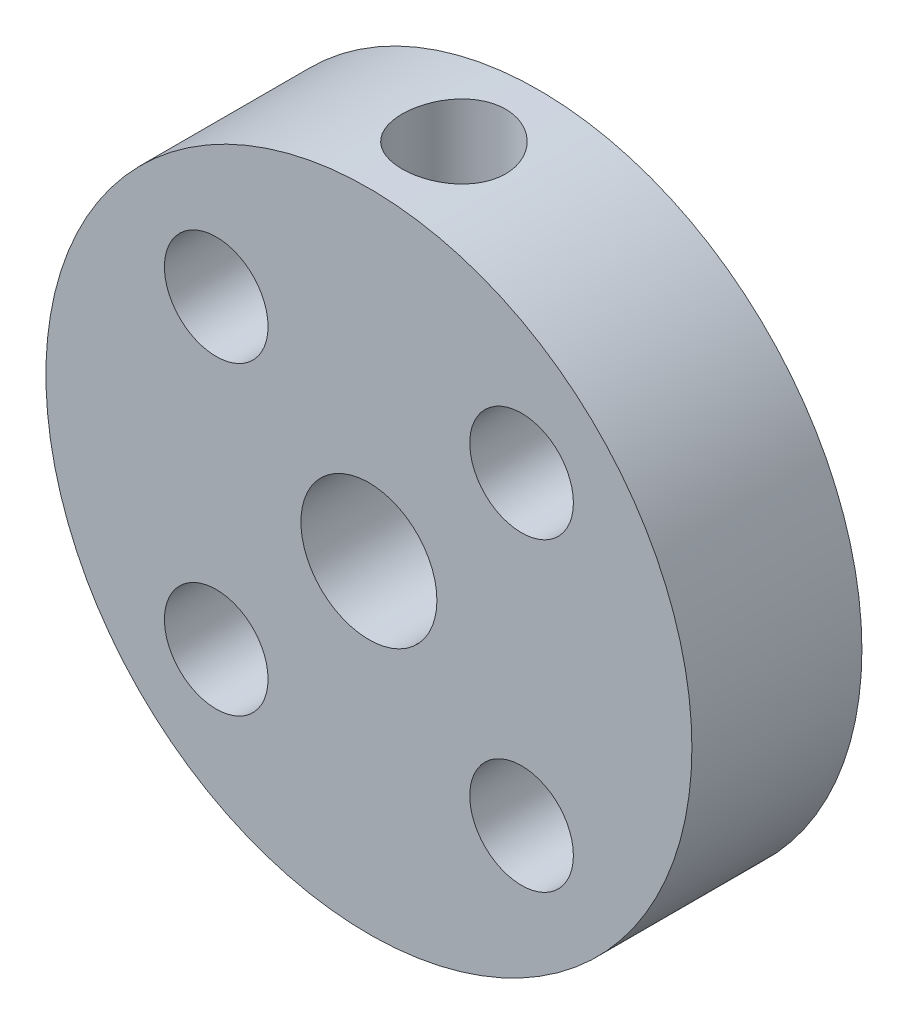
from build123d import *

# Parameters (mm, degrees)
SKETCH1_R                           = 9.5
SKETCH1_R_2                         = 1.524
SKETCH1_R_3                         = 2
BOSS_EXTRUDE1_DEPTH                 = 5
CUT_EXTRUDE1_REACH                  = 18.452
CUT_EXTRUDE1_END_RADIUS             = 2
SKETCH3_R                           = 1.524
CUT_EXTRUDE1_DIRECTION_2_REACH      = 18.452
CUT_EXTRUDE1_DIRECTION_2_END_RADIUS = 9.5


with BuildPart() as part:
    # Sketch1 → Boss-Extrude1 (new body)
    with BuildSketch(Plane.XY):
        Circle(SKETCH1_R)
        with Locations((4.490128061, -4.490128061)):
            Circle(SKETCH1_R_2, mode=Mode.SUBTRACT)
        with Locations((-4.490128061, -4.490128061)):
            Circle(SKETCH1_R_2, mode=Mode.SUBTRACT)
        with Locations((-4.490128061, 4.490128061)):
            Circle(SKETCH1_R_2, mode=Mode.SUBTRACT)
        with Locations((4.490128061, 4.490128061)):
            Circle(SKETCH1_R_2, mode=Mode.SUBTRACT)
        Circle(SKETCH1_R_3, mode=Mode.SUBTRACT)
    extrude(amount=BOSS_EXTRUDE1_DEPTH)

    # Cut-Extrude1: up to this cylinder (the profile starts outside it)
    cut_extrude1_end = Plane(origin=(0, 0, 2.5), z_dir=(0, 0, -1)) * Cylinder(CUT_EXTRUDE1_END_RADIUS, 41.904, mode=Mode.PRIVATE)
    # Sketch3 → Cut-Extrude1 (cut, up to the surface)
    with BuildSketch(Plane(origin=(0, 2.966128061, 0), x_dir=(1, 0, 0), z_dir=(0, 1, 0)), mode=Mode.PRIVATE) as cut_extrude1_sk1:
        with Locations(Location((0, -2.5, 0), (0, 0, 180))):
            Circle(SKETCH3_R)
    cut_extrude1_tool1 = extrude(cut_extrude1_sk1.sketch, amount=-CUT_EXTRUDE1_REACH, mode=Mode.PRIVATE) - cut_extrude1_end
    add(cut_extrude1_tool1.solids().sort_by_distance((0, 2.966128, 2.5))[0], mode=Mode.SUBTRACT)

    # Cut-Extrude1 direction 2: up to this cylinder (the profile starts inside it)
    cut_extrude1_direction_2_end = Plane(origin=(0, 0, 2.5), z_dir=(0, 0, -1)) * Cylinder(CUT_EXTRUDE1_DIRECTION_2_END_RADIUS, 56.904, mode=Mode.PRIVATE)
    # Sketch3 → Cut-Extrude1 direction 2 (cut, up to the surface)
    with BuildSketch(Plane(origin=(0, 2.966128061, 0), x_dir=(1, 0, 0), z_dir=(0, 1, 0)), mode=Mode.PRIVATE) as cut_extrude1_direction_2_sk1:
        with Locations(Location((0, -2.5, 0), (0, 0, 180))):
            Circle(SKETCH3_R)
    cut_extrude1_direction_2_tool1 = extrude(cut_extrude1_direction_2_sk1.sketch, amount=CUT_EXTRUDE1_DIRECTION_2_REACH, mode=Mode.PRIVATE) & cut_extrude1_direction_2_end
    add(cut_extrude1_direction_2_tool1.solids().sort_by_distance((0, 2.966128, 2.5))[0], mode=Mode.SUBTRACT)


solid = part.part
